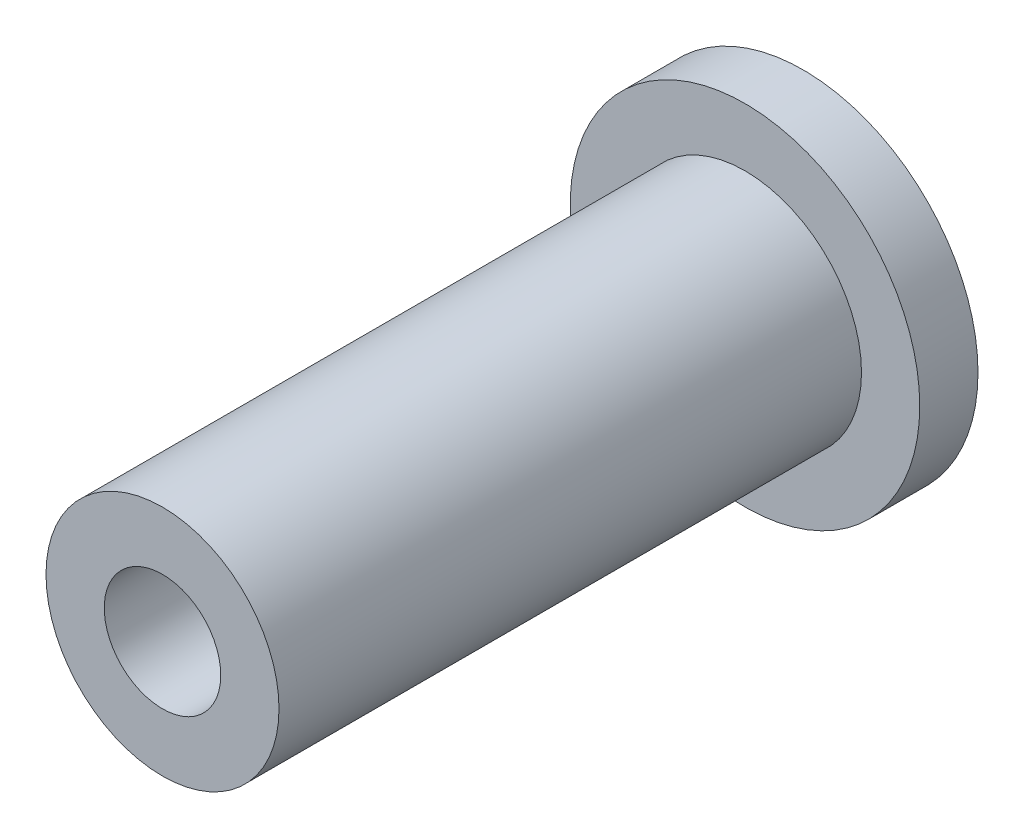
from build123d import *

# Parameters (mm, degrees)
SKETCH2_R           = 20
SKETCH2_R_2         = 10
BOSS_EXTRUDE1_DEPTH = 110
SKETCH3_R           = 30
BOSS_EXTRUDE2_DEPTH = 10
CUT_EXTRUDE1_START  = -10
SKETCH4_R           = 10
CUT_EXTRUDE1_DEPTH  = 10


with BuildPart() as part:
    # Sketch2 → Boss-Extrude1 (new body)
    with BuildSketch(Plane(origin=(0, 0, 0), x_dir=(0, 1, 0), z_dir=(0, 0, 1))):
        with Locations(Location((0, 0, 0), (0, 0, 270))):
            Circle(SKETCH2_R)
        with Locations(Location((0, 0, 0), (0, 0, 270))):
            Circle(SKETCH2_R_2, mode=Mode.SUBTRACT)
    extrude(amount=BOSS_EXTRUDE1_DEPTH)

    # Sketch3 → Boss-Extrude2 (add)
    with BuildSketch(Plane(origin=(0, 0, 0), x_dir=(0, 1, 0), z_dir=(0, 0, 1))):
        with Locations(Location((0, 0, 0), (0, 0, 270))):
            Circle(SKETCH3_R)
    extrude(amount=BOSS_EXTRUDE2_DEPTH)

    # Sketch4 → Cut-Extrude1 (cut)
    with BuildSketch(Plane.XY.offset(10).offset(CUT_EXTRUDE1_START)):
        Circle(SKETCH4_R)
    extrude(amount=CUT_EXTRUDE1_DEPTH, mode=Mode.SUBTRACT)


solid = part.part
